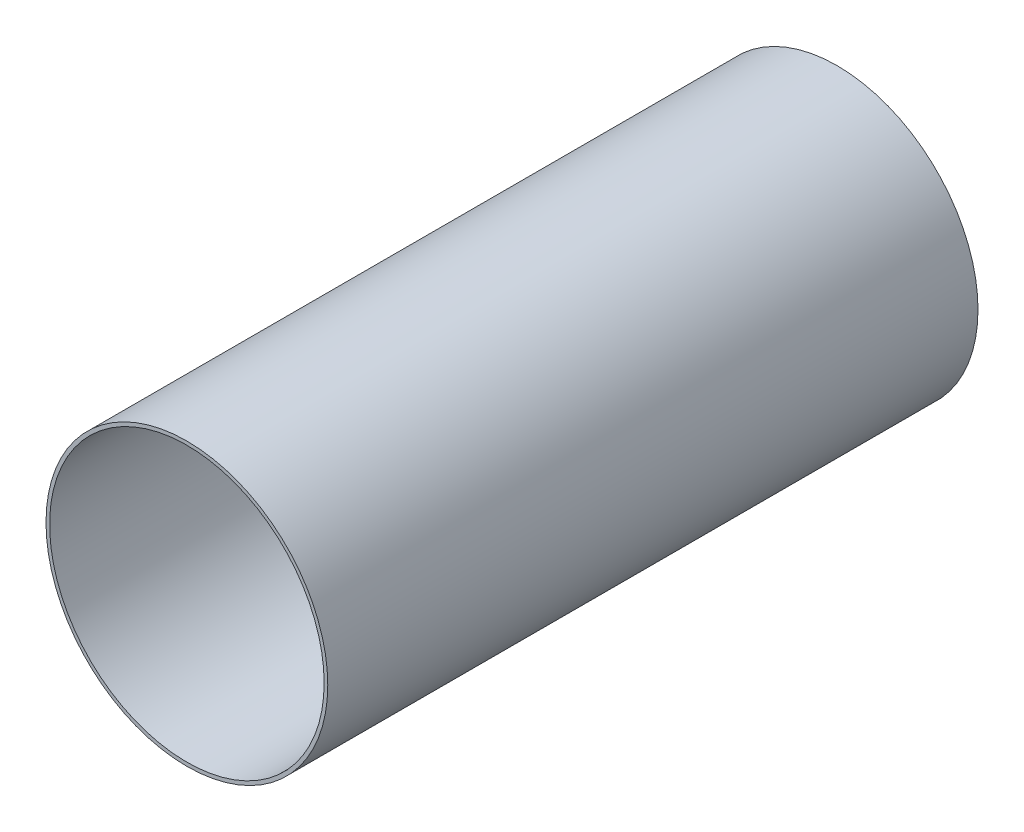
from build123d import *

# Parameters (mm, degrees)
SKETCH1_R           = 49.53
SKETCH1_R_2         = 48.26
BOSS_EXTRUDE1_DEPTH = 228.6


with BuildPart() as part:
    # Sketch1 → Boss-Extrude1 (new body)
    with BuildSketch(Plane.XY):
        Circle(SKETCH1_R)
        Circle(SKETCH1_R_2, mode=Mode.SUBTRACT)
    extrude(amount=BOSS_EXTRUDE1_DEPTH)


solid = part.part
